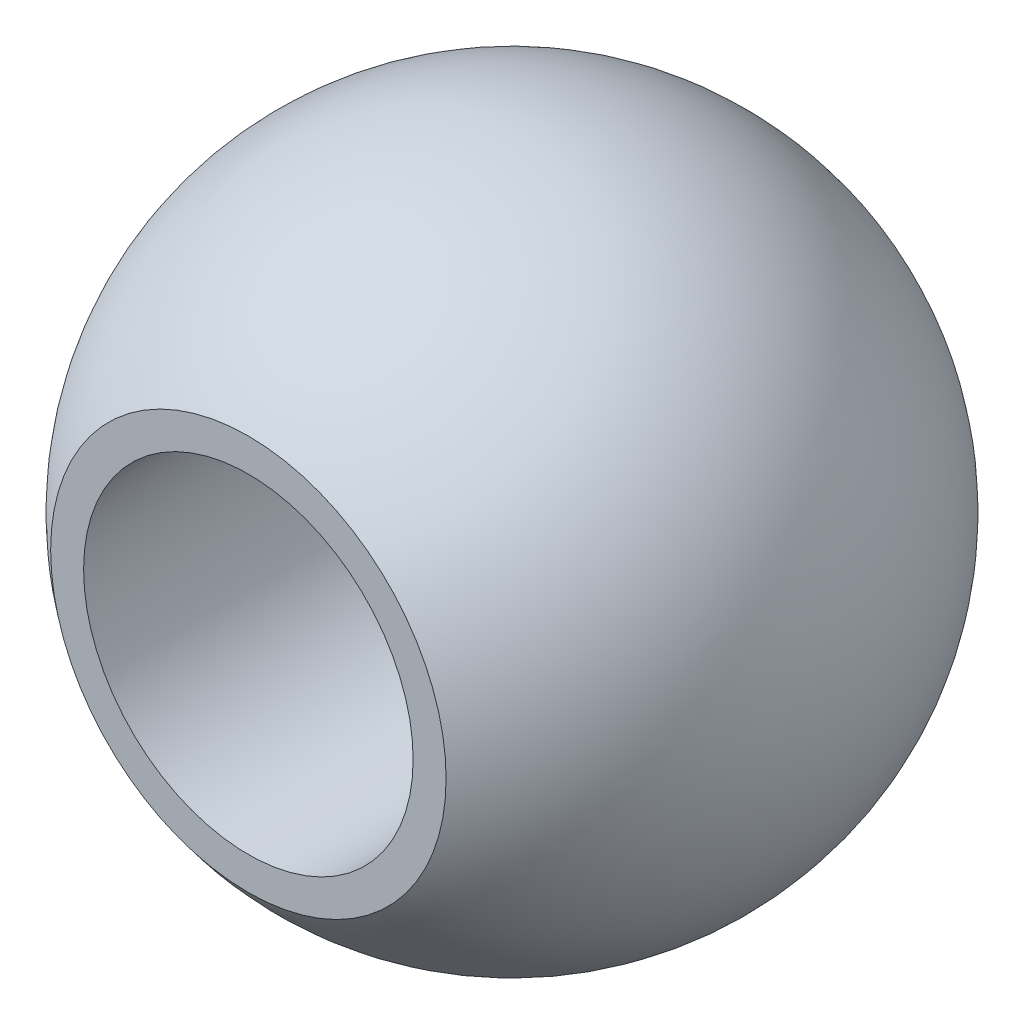
from build123d import *


with BuildPart() as part:
    # Sketch2 → Revolve2 (revolve)
    with BuildSketch(Plane(origin=(0, 0, 0), x_dir=(0, 0, -1), z_dir=(1, 0, 0))):
        with BuildLine():
            ThreePointArc((4, 3), (0, 5), (-4, 3))
            Line((-4, 3), (-4, 2.5))
            Line((-4, 2.5), (4, 2.5))
            Line((4, 2.5), (4, 3))
        make_face()
    revolve(axis=Axis((0, 0, -10), (0, 0, 1)))


solid = part.part
